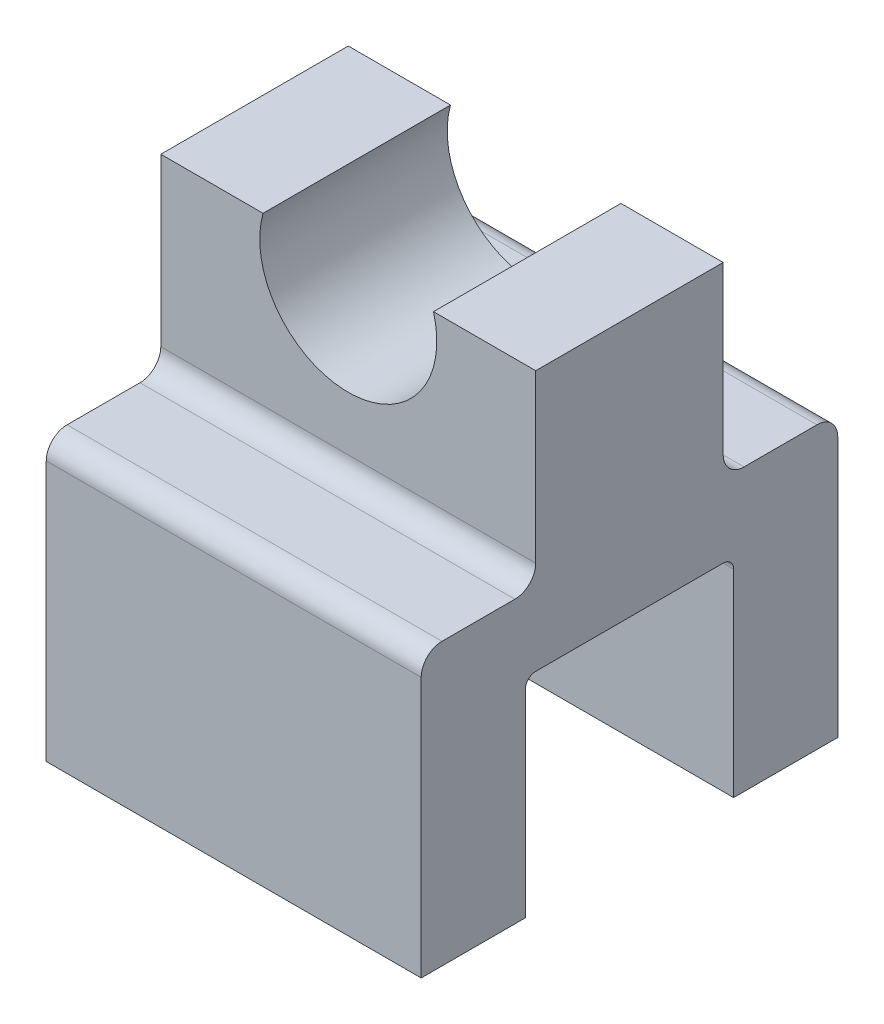
from build123d import *

# Parameters (mm, degrees)
BOSS_EXTRUDE1_DEPTH = 50.8
SKETCH2_W           = 25.4
SKETCH2_H           = 25.4
CUT_EXTRUDE1_DEPTH  = 90.090296329
FILLET1_R           = 1.27
SKETCH4_W           = 13.97
SKETCH4_H           = 22.86
CUT_EXTRUDE2_DEPTH  = 90.090296329
FILLET2_R           = 2.54


with BuildPart() as part:
    # Sketch1 → Boss-Extrude1 (new body)
    with BuildSketch(Plane.XY):
        with BuildLine():
            Line((33.252294453, 57.15), (45.72, 57.15))
            Line((45.72, 57.15), (45.72, 0))
            Line((45.72, 0), (0, 0))
            Line((0, 0), (0, 57.15))
            Line((0, 57.15), (12.467705547, 57.15))
            ThreePointArc((12.467705547, 57.15), (22.86, 43.434), (33.252294453, 57.15))
        make_face()
    extrude(amount=BOSS_EXTRUDE1_DEPTH)

    # Sketch2 → Cut-Extrude1 (cut, through all)
    with BuildSketch(Plane(origin=(45.72, 0, 0), x_dir=(0, 0, -1), z_dir=(1, 0, 0))):
        with Locations((-25.4, 12.7)):
            Rectangle(SKETCH2_W, SKETCH2_H)
    extrude(amount=-CUT_EXTRUDE1_DEPTH, mode=Mode.SUBTRACT)

    # Fillet1
    fillet1_edges = [part.edges().sort_by_distance(p)[0] for p in [
        (22.86, 25.4, 38.1),
        (22.86, 25.4, 12.7),
    ]]
    fillet(fillet1_edges, radius=FILLET1_R)

    # Sketch4 → Cut-Extrude2 (cut, through all)
    with BuildSketch(Plane.ZY):
        with Locations((43.815, 45.72)):
            Rectangle(SKETCH4_W, SKETCH4_H)
        with Locations((6.985, 45.72)):
            Rectangle(SKETCH4_W, SKETCH4_H)
    extrude(amount=-CUT_EXTRUDE2_DEPTH, mode=Mode.SUBTRACT)

    # Fillet2
    fillet2_edges = [part.edges().sort_by_distance(p)[0] for p in [
        (22.86, 34.29, 36.83),
        (22.86, 34.29, 50.8),
        (22.86, 34.29, 0),
        (22.86, 34.29, 13.97),
    ]]
    fillet(fillet2_edges, radius=FILLET2_R)


solid = part.part
